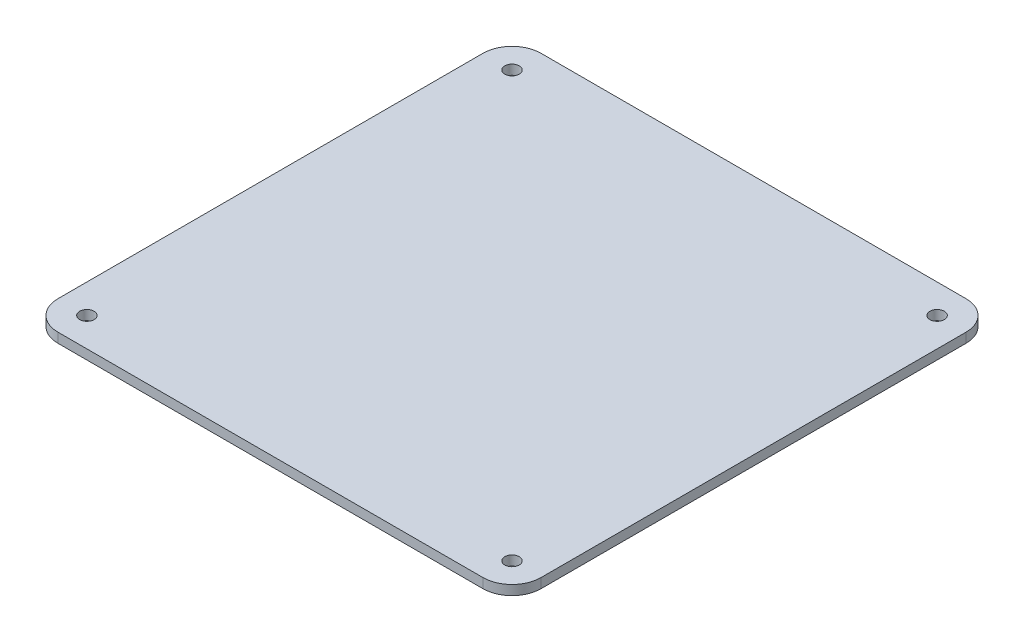
from build123d import *

# Parameters (mm, degrees)
SKETCH1_W           = 100
SKETCH1_H           = 100
BOSS_EXTRUDE1_DEPTH = 2
FILLET1_R           = 6
SKETCH2_R           = 1.5
CUT_EXTRUDE1_DEPTH  = 71.738956735


with BuildPart() as part:
    # Sketch1 → Boss-Extrude1 (new body)
    with BuildSketch(Plane(origin=(0, 0, 0), x_dir=(1, 0, 0), z_dir=(0, 1, 0))):
        Rectangle(SKETCH1_W, SKETCH1_H)
    extrude(amount=BOSS_EXTRUDE1_DEPTH)

    # Fillet1
    fillet1_edges = [part.edges().sort_by_distance(p)[0] for p in [
        (-50, 1, -50),
        (50, 1, -50),
        (50, 1, 50),
        (-50, 1, 50),
    ]]
    fillet(fillet1_edges, radius=FILLET1_R)

    # Sketch2 → Cut-Extrude1 (cut, through all)
    with BuildSketch(Plane(origin=(0, 2, 0), x_dir=(1, 0, 0), z_dir=(0, 1, 0))):
        with Locations(Location((-44, -44, 0), (0, 0, 270))):
            Circle(SKETCH2_R)
        with Locations(Location((-44, 44, 0), (0, 0, 270))):
            Circle(SKETCH2_R)
        with Locations(Location((44, 44, 0), (0, 0, 270))):
            Circle(SKETCH2_R)
        with Locations(Location((44, -44, 0), (0, 0, 270))):
            Circle(SKETCH2_R)
    extrude(amount=-CUT_EXTRUDE1_DEPTH, mode=Mode.SUBTRACT)


solid = part.part
